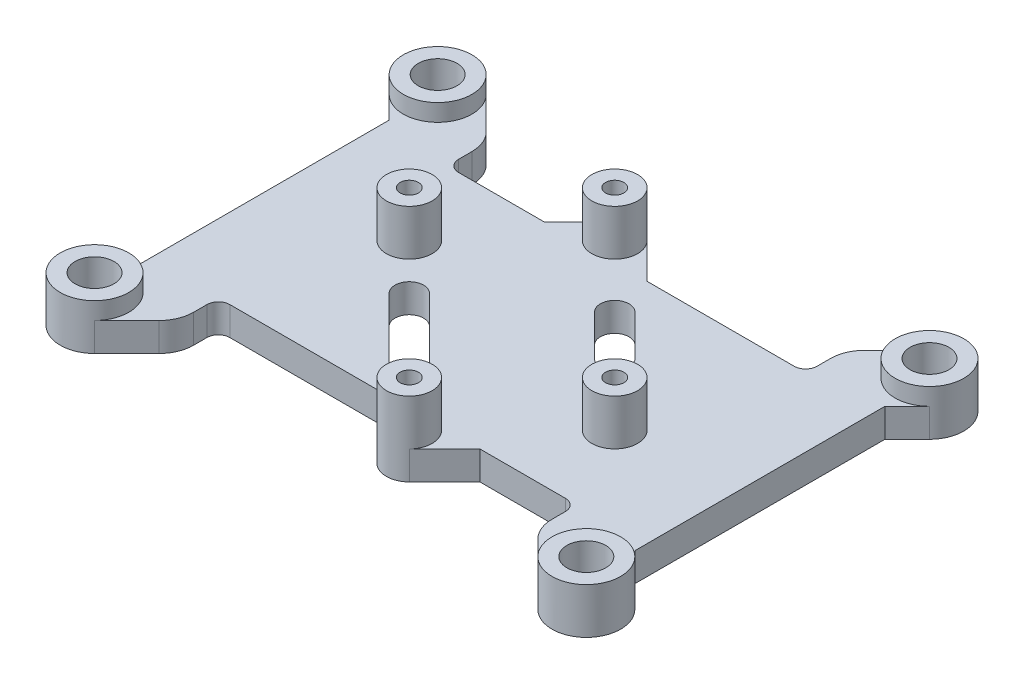
from build123d import *
from build123d.topology import SkipClean

# Parameters (mm, degrees)
SKETCH1_R                       = 3
SKETCH1_R_2                     = 1.7
BOSS_EXTRUDE1_DEPTH             = 4
BOSS_EXTRUDE1_2_DEPTH           = 4
BOSS_EXTRUDE1_3_DEPTH           = 4
BOSS_EXTRUDE1_4_DEPTH           = 4
BOSS_EXTRUDE2_DEPTH             = 2.5
CUT_EXTRUDE1_DEPTH              = 31.663496213
CUT_EXTRUDE1_DEPTH_BACK         = 31.663496213
SKETCH1_2_R                     = 1.7
SKETCH4_W                       = 31.34314575
SKETCH4_H                       = 20
BOSS_EXTRUDE3_DEPTH             = 2.5
FILLET2_R                       = 1
SKETCH9_R                       = 2
SKETCH9_R_2                     = 0.8
BOSS_EXTRUDE8_DEPTH             = 4
BOSS_EXTRUDE8_DIRECTION_2_REACH = 32.504
BOSS_EXTRUDE9_START             = -2.5
BOSS_EXTRUDE9_DEPTH             = 2.5
CUT_EXTRUDE3_START              = -7
SKETCH9_2_R                     = 0.8
CUT_EXTRUDE3_DEPTH              = 7
CUT_EXTRUDE4_DEPTH              = 31.663496213
CUT_EXTRUDE4_DEPTH_BACK         = 31.663496213


with BuildPart() as part:
    # Sketch1 → Boss-Extrude1 (new body)
    with BuildSketch(Plane(origin=(0, 0, 0), x_dir=(1, 0, 0), z_dir=(0, 1, 0))):
        with Locations(Location((-21.5, 15, 0), (0, 0, 270))):
            Circle(SKETCH1_R)
        with Locations(Location((-21.5, 15, 0), (0, 0, 270))):
            Circle(SKETCH1_R_2, mode=Mode.SUBTRACT)
    extrude(amount=BOSS_EXTRUDE1_DEPTH)



with BuildPart() as body_2:
    # Sketch1 → Boss-Extrude1 2 (new body)
    with BuildSketch(Plane(origin=(0, 0, 0), x_dir=(1, 0, 0), z_dir=(0, 1, 0))):
        with Locations(Location((-21.5, -15, 0), (0, 0, 270))):
            Circle(SKETCH1_R)
        with Locations(Location((-21.5, -15, 0), (0, 0, 270))):
            Circle(SKETCH1_R_2, mode=Mode.SUBTRACT)
    extrude(amount=BOSS_EXTRUDE1_2_DEPTH)


with BuildPart() as body_3:
    # Sketch1 → Boss-Extrude1 3 (new body)
    with BuildSketch(Plane(origin=(0, 0, 0), x_dir=(1, 0, 0), z_dir=(0, 1, 0))):
        with Locations(Location((21.5, -15, 0), (0, 0, 270))):
            Circle(SKETCH1_R)
        with Locations(Location((21.5, -15, 0), (0, 0, 270))):
            Circle(SKETCH1_R_2, mode=Mode.SUBTRACT)
    extrude(amount=BOSS_EXTRUDE1_3_DEPTH)


with BuildPart() as body_4:
    # Sketch1 → Boss-Extrude1 4 (new body)
    with BuildSketch(Plane(origin=(0, 0, 0), x_dir=(1, 0, 0), z_dir=(0, 1, 0))):
        with Locations(Location((21.5, 15, 0), (0, 0, 270))):
            Circle(SKETCH1_R)
        with Locations(Location((21.5, 15, 0), (0, 0, 270))):
            Circle(SKETCH1_R_2, mode=Mode.SUBTRACT)
    extrude(amount=BOSS_EXTRUDE1_4_DEPTH)


with BuildPart() as part_1:
    with SkipClean():  # the faces are left unmerged after this step: merging them gives an invalid solid
        add(part.part)

        add(body_2.part)  # Boss-Extrude2 merges body 2

        add(body_3.part)  # Boss-Extrude2 merges body 3

        add(body_4.part)  # Boss-Extrude2 merges body 4
        # Sketch2 → Boss-Extrude2 (add)
        with BuildSketch(Plane(origin=(0, 0, 0), x_dir=(1, 0, 0), z_dir=(0, 1, 0))):
            with BuildLine():
                Line((-15.671572875, 12.171572875), (-15.671572875, -12.171572875))
                ThreePointArc((-15.671572875, -12.171572875), (-15.899934278, -13.319623172), (-16.550252532, -14.292893219))
                Line((-16.550252532, -14.292893219), (-19.378679656, -17.121320344))
                ThreePointArc((-19.378679656, -17.121320344), (-23.621320344, -17.121320344), (-23.621320344, -12.878679656))
                Line((-23.621320344, -12.878679656), (-21.671572875, -10.928932188))
                Line((-21.671572875, -10.928932188), (-21.671572875, 10.928932188))
                Line((-21.671572875, 10.928932188), (-23.621320344, 12.878679656))
                ThreePointArc((-23.621320344, 12.878679656), (-23.621320344, 17.121320344), (-19.378679656, 17.121320344))
                Line((-19.378679656, 17.121320344), (-16.550252532, 14.292893219))
                ThreePointArc((-16.550252532, 14.292893219), (-15.899934278, 13.319623172), (-15.671572875, 12.171572875))
            make_face()
            with BuildLine():
                ThreePointArc((19.378679656, 17.121320344), (23.621320344, 17.121320344), (23.621320344, 12.878679656))
                Line((23.621320344, 12.878679656), (21.671572875, 10.928932188))
                Line((21.671572875, 10.928932188), (21.671572875, -10.928932188))
                Line((21.671572875, -10.928932188), (23.621320344, -12.878679656))
                ThreePointArc((23.621320344, -12.878679656), (23.621320344, -17.121320344), (19.378679656, -17.121320344))
                Line((19.378679656, -17.121320344), (16.550252532, -14.292893219))
                ThreePointArc((16.550252532, -14.292893219), (15.899934278, -13.319623172), (15.671572875, -12.171572875))
                Line((15.671572875, -12.171572875), (15.671572875, 12.171572875))
                ThreePointArc((15.671572875, 12.171572875), (15.899934278, 13.319623172), (16.550252532, 14.292893219))
                Line((16.550252532, 14.292893219), (19.378679656, 17.121320344))
            make_face()
        extrude(amount=BOSS_EXTRUDE2_DEPTH)

    # Sketch1<2> → Cut-Extrude1 (cut, two sides: drawn at the far end of the back side and taken through both)
    with SkipClean():  # the faces are left unmerged after this step: merging them gives an invalid solid
        with BuildSketch(Plane(origin=(0, 0, 0), x_dir=(1, 0, 0), z_dir=(0, 1, 0)).offset(-CUT_EXTRUDE1_DEPTH_BACK)):
            with Locations(Location((-21.5, -15, 0), (0, 0, 270))):
                Circle(SKETCH1_2_R)
            with Locations(Location((-21.5, 15, 0), (0, 0, 270))):
                Circle(SKETCH1_2_R)
            with Locations(Location((21.5, 15, 0), (0, 0, 270))):
                Circle(SKETCH1_2_R)
            with Locations(Location((21.5, -15, 0), (0, 0, 270))):
                Circle(SKETCH1_2_R)
        extrude(amount=CUT_EXTRUDE1_DEPTH + CUT_EXTRUDE1_DEPTH_BACK, mode=Mode.SUBTRACT)

    # Sketch4 → Boss-Extrude3 (add)
    with SkipClean():  # the faces are left unmerged after this step: merging them gives an invalid solid
        with BuildSketch(Plane(origin=(0, 0, 0), x_dir=(1, 0, 0), z_dir=(0, 1, 0))):
            Rectangle(SKETCH4_W, SKETCH4_H)
        extrude(amount=BOSS_EXTRUDE3_DEPTH)

    # Fillet2
    fillet2_edges = [part_1.edges().sort_by_distance(p)[0] for p in [
        (15.671572875, 1.25, 10),
        (15.671572875, 1.25, -10),
        (-15.671572875, 1.25, -10),
        (-15.671572875, 1.25, 10),
    ]]
    fillet(fillet2_edges, radius=FILLET2_R)

    # Sketch9 → Boss-Extrude8 (add)
    # profile 1 of 4: a face of its own
    with SkipClean():  # the faces are left unmerged after this step: merging them gives an invalid solid
        with BuildSketch(Plane(origin=(0, 2.5, 0), x_dir=(1, 0, 0), z_dir=(0, 1, 0))):
            with Locations(Location((-2.694076836, 11.674332957, 0), (0, 0, 270))):
                Circle(SKETCH9_R)
            with Locations(Location((-2.694076836, 11.674332957, 0), (0, 0, 270))):
                Circle(SKETCH9_R_2, mode=Mode.SUBTRACT)
        # profile 2 of 4: a face of its own
        with BuildSketch(Plane(origin=(0, 2.5, 0), x_dir=(1, 0, 0), z_dir=(0, 1, 0))):
            with Locations(Location((-11.674332957, 2.694076836, 0), (0, 0, 270))):
                Circle(SKETCH9_R)
            with Locations(Location((-11.674332957, 2.694076836, 0), (0, 0, 270))):
                Circle(SKETCH9_R_2, mode=Mode.SUBTRACT)
        # profile 3 of 4: a face of its own
        with BuildSketch(Plane(origin=(0, 2.5, 0), x_dir=(1, 0, 0), z_dir=(0, 1, 0))):
            with Locations(Location((11.674332957, -2.694076836, 0), (0, 0, 270))):
                Circle(SKETCH9_R)
            with Locations(Location((11.674332957, -2.694076836, 0), (0, 0, 270))):
                Circle(SKETCH9_R_2, mode=Mode.SUBTRACT)
        # profile 4 of 4: a face of its own
        with BuildSketch(Plane(origin=(0, 2.5, 0), x_dir=(1, 0, 0), z_dir=(0, 1, 0))):
            with Locations(Location((2.694076836, -11.674332957, 0), (0, 0, 270))):
                Circle(SKETCH9_R)
            with Locations(Location((2.694076836, -11.674332957, 0), (0, 0, 270))):
                Circle(SKETCH9_R_2, mode=Mode.SUBTRACT)
        extrude(amount=BOSS_EXTRUDE8_DEPTH)

    # Boss-Extrude8 direction 2: up to this face of the body (flat: up to its plane)
    boss_extrude8_direction_2_end = Plane(part_1.part.faces().sort_by_distance((-19.139719912, 0, 0))[0])
    # Sketch9 → Boss-Extrude8 direction 2 (add, up to the picked face)
    with BuildSketch(Plane(origin=(0, 2.5, 0), x_dir=(1, 0, 0), z_dir=(0, 1, 0)), mode=Mode.PRIVATE) as boss_extrude8_direction_2_sk1:
        with Locations(Location((-2.694076836, 11.674332957, 0), (0, 0, 270))):
            Circle(SKETCH9_R)
        with Locations(Location((-2.694076836, 11.674332957, 0), (0, 0, 270))):
            Circle(SKETCH9_R_2, mode=Mode.SUBTRACT)
    boss_extrude8_direction_2_tool1 = split(extrude(boss_extrude8_direction_2_sk1.sketch, amount=-BOSS_EXTRUDE8_DIRECTION_2_REACH, mode=Mode.PRIVATE), bisect_by=boss_extrude8_direction_2_end, keep=Keep.BOTH, mode=Mode.PRIVATE)
    # Sketch9 → Boss-Extrude8 direction 2 (add, up to the picked face)
    with BuildSketch(Plane(origin=(0, 2.5, 0), x_dir=(1, 0, 0), z_dir=(0, 1, 0)), mode=Mode.PRIVATE) as boss_extrude8_direction_2_sk2:
        with Locations(Location((-11.674332957, 2.694076836, 0), (0, 0, 270))):
            Circle(SKETCH9_R)
        with Locations(Location((-11.674332957, 2.694076836, 0), (0, 0, 270))):
            Circle(SKETCH9_R_2, mode=Mode.SUBTRACT)
    boss_extrude8_direction_2_tool2 = split(extrude(boss_extrude8_direction_2_sk2.sketch, amount=-BOSS_EXTRUDE8_DIRECTION_2_REACH, mode=Mode.PRIVATE), bisect_by=boss_extrude8_direction_2_end, keep=Keep.BOTH, mode=Mode.PRIVATE)
    # Sketch9 → Boss-Extrude8 direction 2 (add, up to the picked face)
    with BuildSketch(Plane(origin=(0, 2.5, 0), x_dir=(1, 0, 0), z_dir=(0, 1, 0)), mode=Mode.PRIVATE) as boss_extrude8_direction_2_sk3:
        with Locations(Location((11.674332957, -2.694076836, 0), (0, 0, 270))):
            Circle(SKETCH9_R)
        with Locations(Location((11.674332957, -2.694076836, 0), (0, 0, 270))):
            Circle(SKETCH9_R_2, mode=Mode.SUBTRACT)
    boss_extrude8_direction_2_tool3 = split(extrude(boss_extrude8_direction_2_sk3.sketch, amount=-BOSS_EXTRUDE8_DIRECTION_2_REACH, mode=Mode.PRIVATE), bisect_by=boss_extrude8_direction_2_end, keep=Keep.BOTH, mode=Mode.PRIVATE)
    # Sketch9 → Boss-Extrude8 direction 2 (add, up to the picked face)
    with BuildSketch(Plane(origin=(0, 2.5, 0), x_dir=(1, 0, 0), z_dir=(0, 1, 0)), mode=Mode.PRIVATE) as boss_extrude8_direction_2_sk4:
        with Locations(Location((2.694076836, -11.674332957, 0), (0, 0, 270))):
            Circle(SKETCH9_R)
        with Locations(Location((2.694076836, -11.674332957, 0), (0, 0, 270))):
            Circle(SKETCH9_R_2, mode=Mode.SUBTRACT)
    boss_extrude8_direction_2_tool4 = split(extrude(boss_extrude8_direction_2_sk4.sketch, amount=-BOSS_EXTRUDE8_DIRECTION_2_REACH, mode=Mode.PRIVATE), bisect_by=boss_extrude8_direction_2_end, keep=Keep.BOTH, mode=Mode.PRIVATE)
    add(boss_extrude8_direction_2_tool1.solids().sort_by(Axis((-2.694077, 2.5, -13.617764), (0, -1, 0)))[0])
    add(boss_extrude8_direction_2_tool2.solids().sort_by(Axis((-11.674333, 2.5, -4.637508), (0, -1, 0)))[0])
    add(boss_extrude8_direction_2_tool3.solids().sort_by(Axis((11.674333, 2.5, 0.750645), (0, -1, 0)))[0])
    add(boss_extrude8_direction_2_tool4.solids().sort_by(Axis((2.694077, 2.5, 9.730901), (0, -1, 0)))[0])

    # Sketch10 → Boss-Extrude9 (add)
    with SkipClean():  # the faces are left unmerged after this step: merging them gives an invalid solid
        with BuildSketch(Plane(origin=(0, 2.5, 0), x_dir=(1, 0, 0), z_dir=(0, 1, 0)).offset(BOSS_EXTRUDE9_START)):
            with BuildLine():
                Line((-13.08854652, 1.279863274), (1.279863274, -13.08854652))
                ThreePointArc((1.279863274, -13.08854652), (2.694076836, -13.674332957), (4.108290399, -13.08854652))
                Line((4.108290399, -13.08854652), (13.08854652, -4.108290399))
                ThreePointArc((13.08854652, -4.108290399), (13.674332957, -2.694076836), (13.08854652, -1.279863274))
                Line((13.08854652, -1.279863274), (-1.279863274, 13.08854652))
                ThreePointArc((-1.279863274, 13.08854652), (-2.694076836, 13.674332957), (-4.108290399, 13.08854652))
                Line((-4.108290399, 13.08854652), (-13.08854652, 4.108290399))
                ThreePointArc((-13.08854652, 4.108290399), (-13.674332957, 2.694076836), (-13.08854652, 1.279863274))
            make_face()
        extrude(amount=BOSS_EXTRUDE9_DEPTH)

    # Sketch9<2> → Cut-Extrude3 (cut)
    with SkipClean():  # the faces are left unmerged after this step: merging them gives an invalid solid
        with BuildSketch(Plane(origin=(0, 2.5, 0), x_dir=(1, 0, 0), z_dir=(0, 1, 0)).offset(CUT_EXTRUDE3_START)):
            with Locations(Location((-11.674332957, 2.694076836, 0), (0, 0, 270))):
                Circle(SKETCH9_2_R)
            with Locations(Location((-2.694076836, 11.674332957, 0), (0, 0, 270))):
                Circle(SKETCH9_2_R)
            with Locations(Location((2.694076836, -11.674332957, 0), (0, 0, 270))):
                Circle(SKETCH9_2_R)
            with Locations(Location((11.674332957, -2.694076836, 0), (0, 0, 270))):
                Circle(SKETCH9_2_R)
        extrude(amount=CUT_EXTRUDE3_DEPTH, mode=Mode.SUBTRACT)

    # Sketch11 → Cut-Extrude4 (cut, two sides: drawn at the far end of the back side and taken through both)
    with SkipClean():  # the faces are left unmerged after this step: merging them gives an invalid solid
        with BuildSketch(Plane(origin=(0, 2.5, 0), x_dir=(1, 0, 0), z_dir=(0, 1, 0)).offset(-CUT_EXTRUDE4_DEPTH_BACK)):
            with BuildLine():
                Line((-6.788225099, -0.424264069), (-0.424264069, -6.788225099))
                ThreePointArc((-0.424264069, -6.788225099), (-0.424264069, -8.555992052), (-2.192031022, -8.555992052))
                Line((-2.192031022, -8.555992052), (-8.555992052, -2.192031022))
                ThreePointArc((-8.555992052, -2.192031022), (-8.555992052, -0.424264069), (-6.788225099, -0.424264069))
            make_face()
            with BuildLine():
                Line((3.606244584, 7.14177849), (7.14177849, 3.606244584))
                ThreePointArc((7.14177849, 3.606244584), (7.14177849, 1.838477631), (5.374011537, 1.838477631))
                Line((5.374011537, 1.838477631), (1.838477631, 5.374011537))
                ThreePointArc((1.838477631, 5.374011537), (1.838477631, 7.14177849), (3.606244584, 7.14177849))
            make_face()
        extrude(amount=CUT_EXTRUDE4_DEPTH + CUT_EXTRUDE4_DEPTH_BACK, mode=Mode.SUBTRACT)


solid = part_1.part
